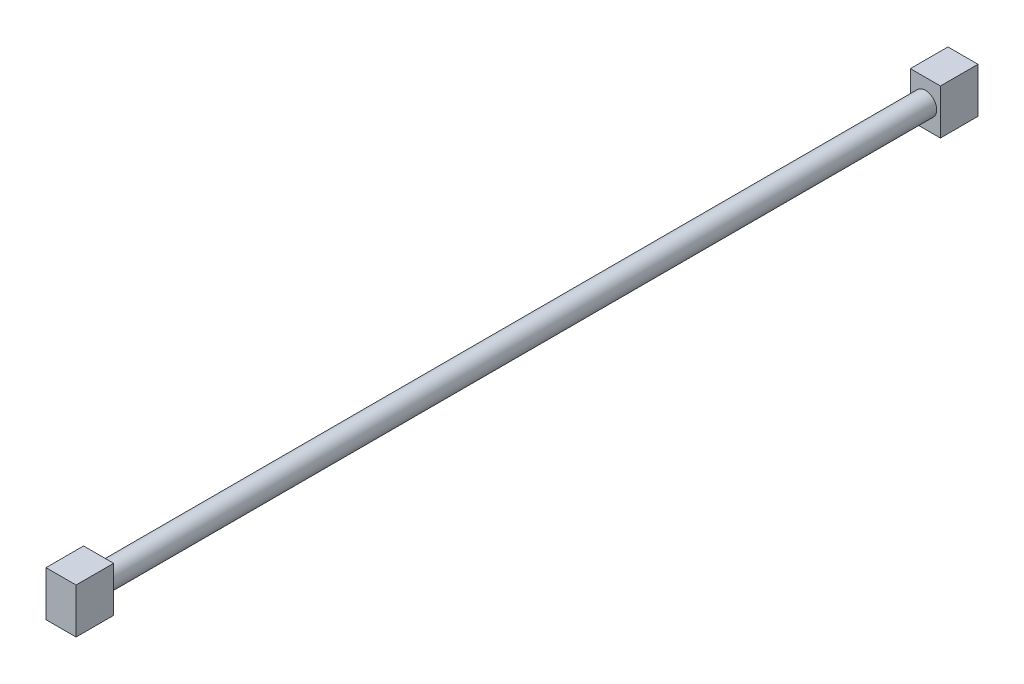
from build123d import *

# Parameters (mm, degrees)
SKETCH2_W           = 5.08
SKETCH2_H           = 7.62
BOSS_EXTRUDE1_DEPTH = 6.35
SKETCH3_R           = 1.905
BOSS_EXTRUDE2_DEPTH = 139.7
SKETCH4_W           = 5.08
SKETCH4_H           = 7.62
BOSS_EXTRUDE3_DEPTH = 6.35


with BuildPart() as part:
    # Sketch2 → Boss-Extrude1 (new body)
    with BuildSketch(Plane.XY):
        Rectangle(SKETCH2_W, SKETCH2_H)
    extrude(amount=BOSS_EXTRUDE1_DEPTH)

    # Sketch3 → Boss-Extrude2 (add)
    with BuildSketch(Plane.XY.offset(6.35)):
        Circle(SKETCH3_R)
    extrude(amount=BOSS_EXTRUDE2_DEPTH)

    # Sketch4 → Boss-Extrude3 (add)
    with BuildSketch(Plane.XY.offset(146.05)):
        Rectangle(SKETCH4_W, SKETCH4_H)
    extrude(amount=BOSS_EXTRUDE3_DEPTH)


solid = part.part
